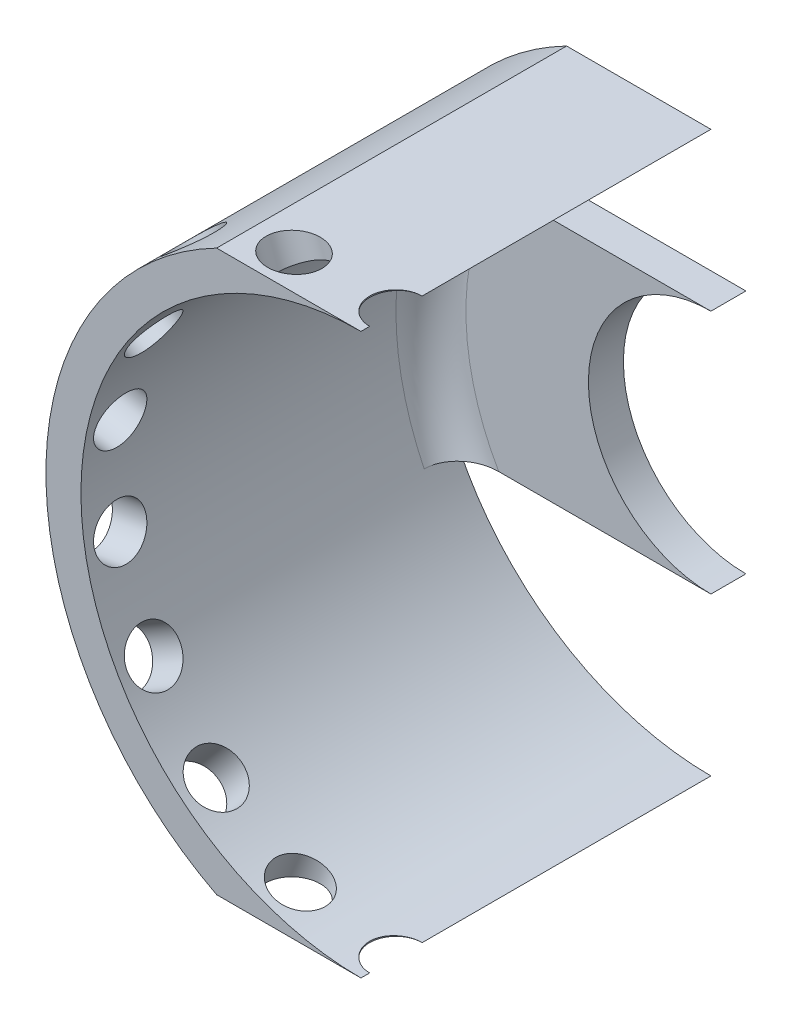
from build123d import *

# Parameters (mm, degrees)
EXTRUDE_1_DEPTH          = 1
EXTRUDE_2_DEPTH          = 10
SKETCH_3_R               = 0.75
CUT_EXTRUDE_1_DEPTH      = 10
PATTERN_CIRCULAR_1_COUNT = 18
FILLET_1_R               = 1


with BuildPart() as part:
    # Эскиз1 → Бобышка-Вытянуть1 (new body)
    with BuildSketch(Plane.XY):
        with BuildLine():
            Line((0, 3.5), (-8.291561976, 3.5))
            ThreePointArc((-8.291561976, 3.5), (-9, 0), (-8.291561976, -3.5))
            Line((-8.291561976, -3.5), (0, -3.5))
            ThreePointArc((0, -3.5), (-3.5, 0), (0, 3.5))
        make_face()
    extrude(amount=EXTRUDE_1_DEPTH)

    # Эскиз2 → Бобышка-Вытянуть2 (add)
    with BuildSketch(Plane.XY.offset(1)):
        with BuildLine():
            Line((5.61e-07, 8), (-4.123105626, 8))
            ThreePointArc((-4.123105626, 8), (-9, 0), (-4.123105626, -8))
            Line((-4.123105626, -8), (2.99e-07, -8))
            ThreePointArc((2.99e-07, -8), (-8, 1.31e-07), (5.61e-07, 8))
        make_face()
    extrude(amount=EXTRUDE_2_DEPTH)

    # Эскиз3 → Вырез-Вытянуть1 (cut)
    with BuildSketch(Plane(origin=(0, 0, 0), x_dir=(1, 0, 0), z_dir=(0, 1, 0))):
        with Locations((0, -10)):
            Circle(SKETCH_3_R)
    cut_extrude_1 = extrude(amount=-CUT_EXTRUDE_1_DEPTH, mode=Mode.SUBTRACT)

    # Круговой массив1: Вырез-Вытянуть1 ×18 about axis
    pattern_circular_1_axis = Axis((0, 0, 0), (0, 0, -1))
    for i in range(1, PATTERN_CIRCULAR_1_COUNT):
        add(cut_extrude_1.rotate(pattern_circular_1_axis, i * 360 / PATTERN_CIRCULAR_1_COUNT), mode=Mode.SUBTRACT)

    # Скругление1
    fillet_1_edges = [part.edges().sort_by_distance(p)[0] for p in [
        (-8, 0, 1),
    ]]
    fillet(fillet_1_edges, radius=FILLET_1_R)


solid = part.part
